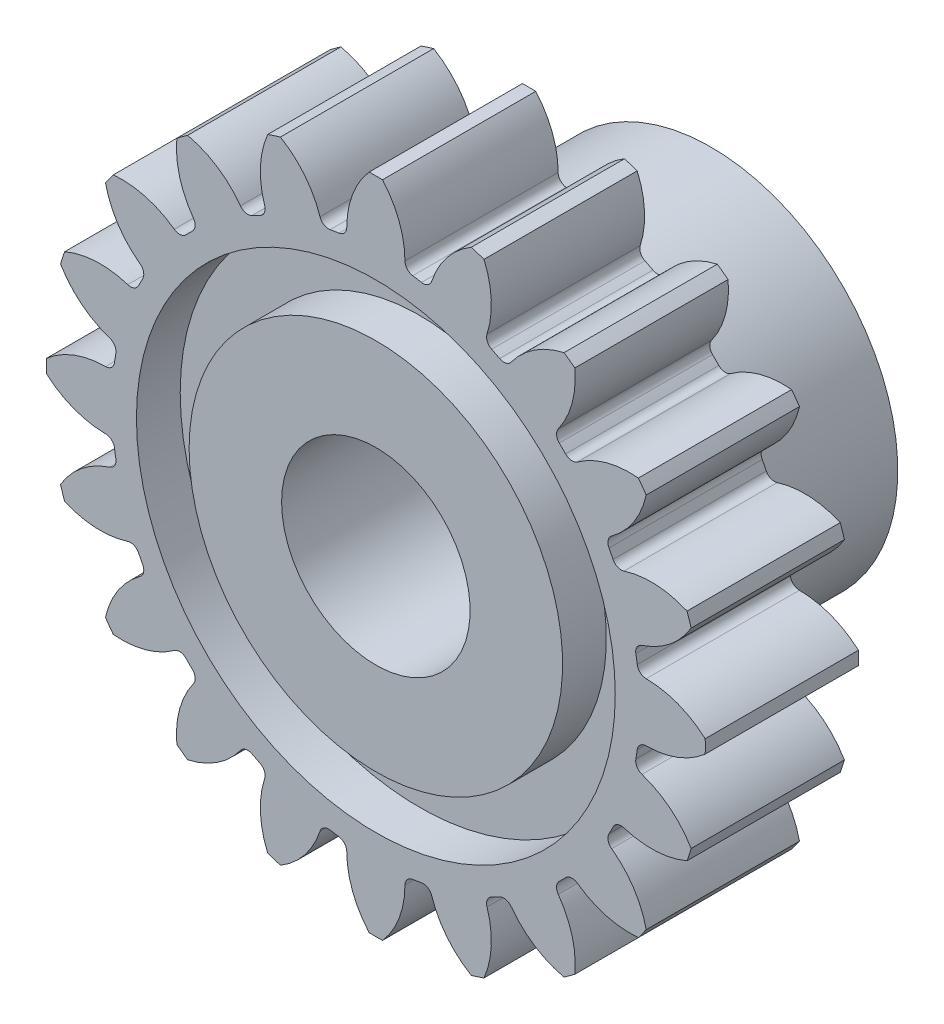
from build123d import *

# Parameters (mm, degrees)
CUT_EXTRUDE1_DEPTH = 16.222463911
CIRPATTERN1_COUNT  = 20


with BuildPart() as part:
    # Sketch3 → Revolve1 (revolve)
    with BuildSketch(Plane(origin=(0, 0, 0), x_dir=(0, 0, -1), z_dir=(1, 0, 0)), mode=Mode.PRIVATE) as revolve1_sk:
        Polygon((-4.445, 8.7376), (-0.381, 8.7376), (-0.381, 6.35), (-1.542142857, 6.35), (-1.542142857, 4.953), (4.445, 4.953), (4.445, 2.5), (-4.445, 2.5), (-4.445, 4.953), (-3.283857143, 4.953), (-3.283857143, 6.35), (-4.445, 6.35), align=None)
    revolve(revolve1_sk.sketch.rotate(Axis((0, 0, -4.445), (0, 0, 1)), 90), axis=Axis((0, 0, -4.445), (0, 0, 1)))

    # Sketch4 → Cut-Extrude1 (cut, symmetric)
    with BuildSketch(Plane.XY.offset(4.445)):
        with BuildLine():
            ThreePointArc((-0.177238976, 8.735802202), (-0.617105517, 8.006665749), (-0.771722734, 7.169279306))
            ThreePointArc((-0.771722734, 7.169279306), (-0.830749469, 7.012225198), (-0.978213262, 6.932196591))
            ThreePointArc((-0.978213262, 6.932196591), (-1.095178135, 6.914682611), (-1.211830458, 6.895195262))
            ThreePointArc((-1.211830458, 6.895195262), (-1.376807059, 6.925738172), (-1.481477208, 7.05686524))
            ThreePointArc((-1.481477208, 7.05686524), (-1.887293562, 7.805487727), (-2.530947057, 8.363011464))
            ThreePointArc((-2.530947057, 8.363011464), (-1.366861782, 8.630025645), (-0.177238976, 8.735802202))
        make_face()
    cut_extrude1 = extrude(amount=CUT_EXTRUDE1_DEPTH, both=True, mode=Mode.SUBTRACT)

    # CirPattern1: Cut-Extrude1 ×20 about axis
    cirpattern1_axis = Axis((0, 0, 0), (0, 0, 1))
    for i in range(1, CIRPATTERN1_COUNT):
        add(cut_extrude1.rotate(cirpattern1_axis, i * 360 / CIRPATTERN1_COUNT), mode=Mode.SUBTRACT)


solid = part.part
